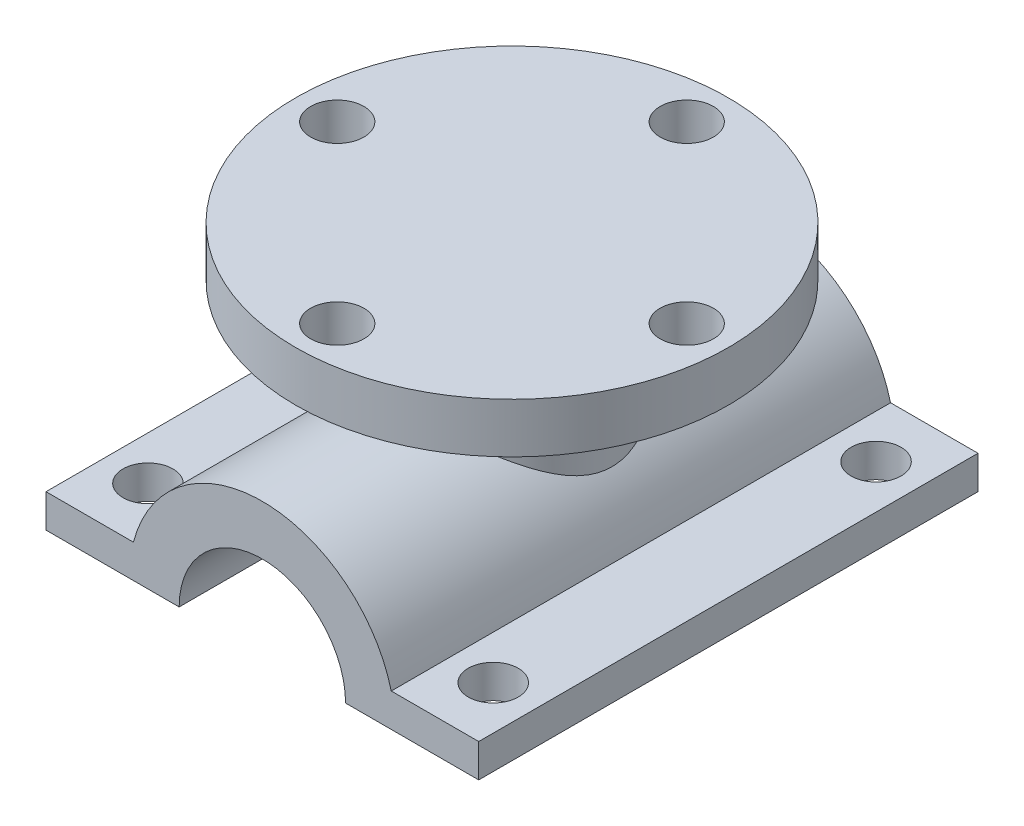
from build123d import *

# Parameters (mm, degrees)
EXTRUDE_1_DEPTH      = 30
SKETCH_2_R           = 1.5
CUT_EXTRUDE_1_DEPTH  = 30
EXTRUDE_2_REACH      = 36.828
EXTRUDE_2_END_RADIUS = 8
SKETCH_3_R           = 6
SKETCH_4_R           = 13
EXTRUDE_3_DEPTH      = 3
SKETCH_6_R           = 1.6
CUT_EXTRUDE_2_DEPTH  = 3


with BuildPart() as part:
    # 草图1 → 凸台-拉伸1 (new body)
    with BuildSketch(Plane.XY):
        with BuildLine():
            Line((-8, 0), (-13, 0))
            Line((-13, 0), (-13, 2))
            Line((-13, 2), (-7.745966692, 2))
            ThreePointArc((-7.745966692, 2), (0, 8), (7.745966692, 2))
            Line((7.745966692, 2), (13, 2))
            Line((13, 2), (13, 0))
            Line((13, 0), (8, 0))
            Line((8, 0), (5, 0))
            ThreePointArc((5, 0), (0, 5), (-5, 0))
            Line((-5, 0), (-8, 0))
        make_face()
    extrude(amount=EXTRUDE_1_DEPTH)

    # 草图2 → 切除-拉伸1 (cut)
    with BuildSketch(Plane(origin=(0, 2, 0), x_dir=(1, 0, 0), z_dir=(0, 1, 0))):
        with Locations(Location((10.372983346, -3.5, 0), (0, 0, 270))):
            Circle(SKETCH_2_R)
        with Locations(Location((10.372983346, -26.5, 0), (0, 0, 180))):
            Circle(SKETCH_2_R)
        with Locations(Location((-10.372983346, -26.5, 0), (0, 0, 270))):
            Circle(SKETCH_2_R)
        with Locations(Location((-10.372983346, -3.5, 0), (0, 0, 270))):
            Circle(SKETCH_2_R)
    extrude(amount=-CUT_EXTRUDE_1_DEPTH, mode=Mode.SUBTRACT)

    # 凸台-拉伸2: up to this cylinder (the profile starts outside it)
    extrude_2_end = Plane(origin=(0, 0, 15), z_dir=(0, 0, -1)) * Cylinder(EXTRUDE_2_END_RADIUS, 90.656, mode=Mode.PRIVATE)
    # 草图3 → 凸台-拉伸2 (add, up to the surface)
    with BuildSketch(Plane(origin=(0, 12, 0), x_dir=(1, 0, 0), z_dir=(0, 1, 0)), mode=Mode.PRIVATE) as extrude_2_sk1:
        with Locations(Location((0, -15, 0), (0, 0, 270))):
            Circle(SKETCH_3_R)
    extrude_2_tool1 = extrude(extrude_2_sk1.sketch, amount=-EXTRUDE_2_REACH, mode=Mode.PRIVATE) - extrude_2_end
    add(extrude_2_tool1.solids().sort_by_distance((0, 12, 15))[0])

    # 草图4 → 凸台-拉伸3 (add)
    with BuildSketch(Plane(origin=(0, 12, 0), x_dir=(1, 0, 0), z_dir=(0, 1, 0))):
        with Locations(Location((0, -15, 0), (0, 0, 270))):
            Circle(SKETCH_4_R)
    extrude(amount=EXTRUDE_3_DEPTH)

    # 草图6 → 切除-拉伸2 (cut)
    with BuildSketch(Plane(origin=(0, 15, 0), x_dir=(1, 0, 0), z_dir=(0, 1, 0))):
        with Locations(Location((10.5, -15, 0), (0, 0, 270))):
            Circle(SKETCH_6_R)
        with Locations(Location((0, -25.5, 0), (0, 0, 270))):
            Circle(SKETCH_6_R)
        with Locations(Location((-10.5, -15, 0), (0, 0, 270))):
            Circle(SKETCH_6_R)
        with Locations(Location((0, -4.5, 0), (0, 0, 270))):
            Circle(SKETCH_6_R)
    extrude(amount=-CUT_EXTRUDE_2_DEPTH, mode=Mode.SUBTRACT)


solid = part.part
